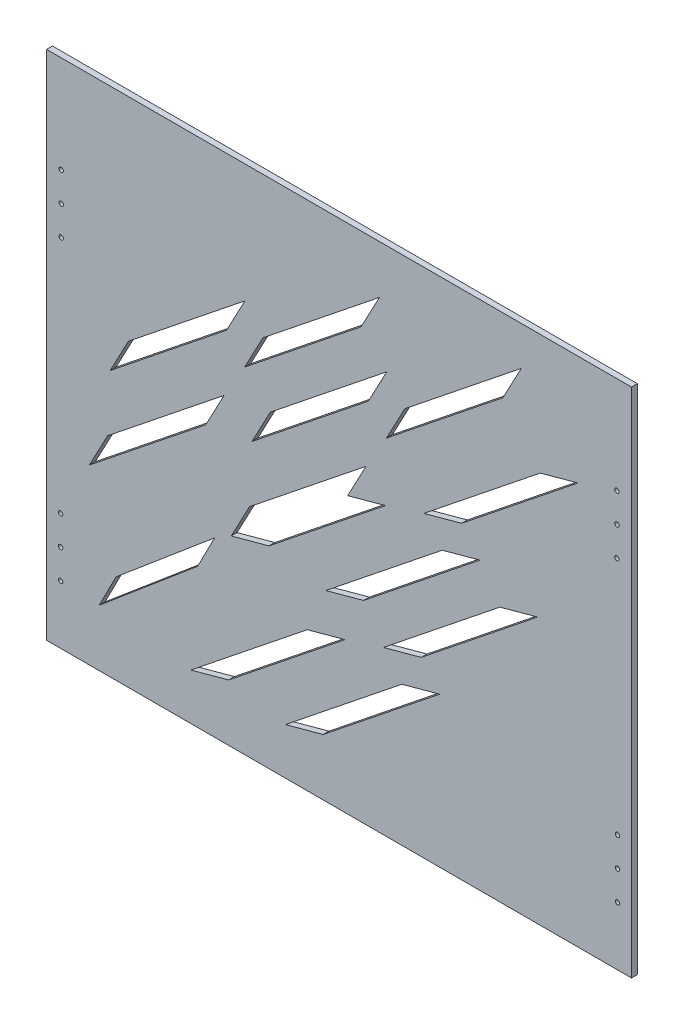
from build123d import *

# Parameters (mm, degrees)
SKETCH1_W           = 400
SKETCH1_H           = 350
SKETCH1_R           = 1.5
BOSS_EXTRUDE1_DEPTH = 4
CUT_EXTRUDE1_DEPTH  = 10


with BuildPart() as part:
    # Sketch1 → Boss-Extrude1 (new body)
    with BuildSketch(Plane.XY):
        Rectangle(SKETCH1_W, SKETCH1_H)
        with Locations((190.420210886, -135)):
            Circle(SKETCH1_R, mode=Mode.SUBTRACT)
        with Locations((190.420210886, -115)):
            Circle(SKETCH1_R, mode=Mode.SUBTRACT)
        with Locations((190.420210886, -95)):
            Circle(SKETCH1_R, mode=Mode.SUBTRACT)
        with Locations((190, 68.62)):
            Circle(SKETCH1_R, mode=Mode.SUBTRACT)
        with Locations((190, 88.62)):
            Circle(SKETCH1_R, mode=Mode.SUBTRACT)
        with Locations((190, 108.62)):
            Circle(SKETCH1_R, mode=Mode.SUBTRACT)
        with Locations(Location((-190.420210886, -135, 0), (0, 0, 180))):
            Circle(SKETCH1_R, mode=Mode.SUBTRACT)
        with Locations(Location((-190.420210886, -95, 0), (0, 0, 180))):
            Circle(SKETCH1_R, mode=Mode.SUBTRACT)
        with Locations(Location((-190.420210886, -115, 0), (0, 0, 180))):
            Circle(SKETCH1_R, mode=Mode.SUBTRACT)
        with Locations(Location((-190, 68.62, 0), (0, 0, 180))):
            Circle(SKETCH1_R, mode=Mode.SUBTRACT)
        with Locations(Location((-190, 88.62, 0), (0, 0, 180))):
            Circle(SKETCH1_R, mode=Mode.SUBTRACT)
        with Locations(Location((-190, 108.62, 0), (0, 0, 180))):
            Circle(SKETCH1_R, mode=Mode.SUBTRACT)
    extrude(amount=BOSS_EXTRUDE1_DEPTH)

    # Sketch2 → Cut-Extrude1 (cut)
    with BuildSketch(Plane.XY.offset(4)):
        Polygon((-76.924392285, 70.222779709), (-156.531783107, 6.536867051), (-143.98758819, 30.17784978), (-64.380197367, 93.863762438), align=None)
        Polygon((15.0683317, 118.246100027), (-64.539059123, 54.560187369), (-51.994864205, 78.201170098), (27.612526617, 141.887082756), align=None)
        Polygon((20.075418883, 76.706692842), (-59.53197194, 13.020780184), (-46.987777022, 36.661762913), (32.6196138, 100.347675571), align=None)
        Polygon((112.068142867, 124.730013159), (32.460752045, 61.044100501), (45.004946962, 84.685083231), (124.612337785, 148.370995889), align=None)
        Polygon((163.398141207, 99.888741611), (83.790750385, 36.202828953), (57.972773228, 29.154074023), (137.580164051, 92.839986681), align=None)
        Polygon((5.854349879, 13.609157056), (-73.753040943, -50.076755602), (-61.208846026, -26.435772873), (18.398544797, 37.250139785), align=None)
        Polygon((31.672327036, 20.657911987), (-47.935063786, -43.028000671), (-73.753040943, -50.076755602), (5.854349879, 13.609157056), align=None)
        Polygon((135.779730821, 6.678077501), (56.172339999, -57.007835157), (30.354362842, -64.056590088), (109.961753665, -0.37067743), align=None)
        Polygon((68.734186222, -72.529217049), (-10.8732046, -136.215129707), (-36.691181757, -143.263884637), (42.916209066, -79.577971979), align=None)
        Polygon((-91.145461288, 7.125243924), (-170.752852111, -56.560668734), (-158.208657193, -32.919686005), (-78.601266371, 30.766226653), align=None)
        Polygon((70.534619452, 13.632692131), (-9.072771371, -50.053220527), (16.745205786, -43.004465597), (96.352596608, 20.681447061), align=None)
        Polygon((-21.764060506, -79.601507054), (-101.371451329, -143.287419712), (-75.553474172, -136.238664782), (4.05391665, -72.552752124), align=None)
        Polygon((-85.129533688, -56.876544129), (-152.460215151, -113.62145781), (-164.039471998, -136.238664782), (-96.708790535, -79.493751101), align=None)
    extrude(amount=-CUT_EXTRUDE1_DEPTH, mode=Mode.SUBTRACT)


solid = part.part
